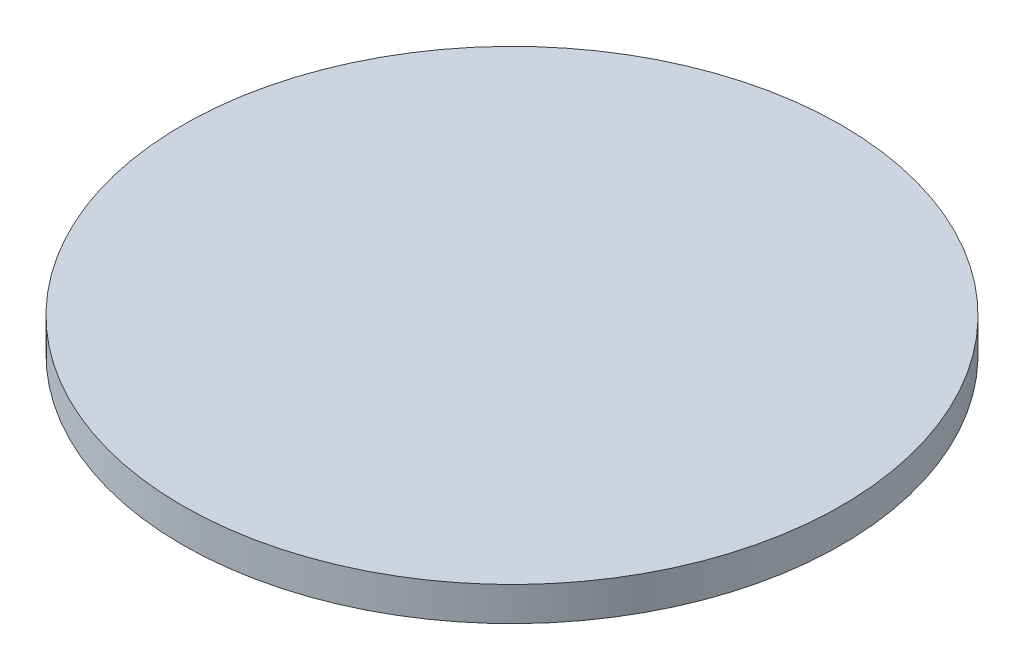
from build123d import *

# Parameters (mm, degrees)
SKETCH1_R           = 97.19068884
BOSS_EXTRUDE1_DEPTH = 10


with BuildPart() as part:
    # Sketch1 → Boss-Extrude1 (new body)
    with BuildSketch(Plane(origin=(0, 0, 0), x_dir=(1, 0, 0), z_dir=(0, 1, 0))):
        with Locations(Location((16.980227673, 0, 0), (0, 0, 270))):
            Circle(SKETCH1_R)
    extrude(amount=BOSS_EXTRUDE1_DEPTH)


solid = part.part
